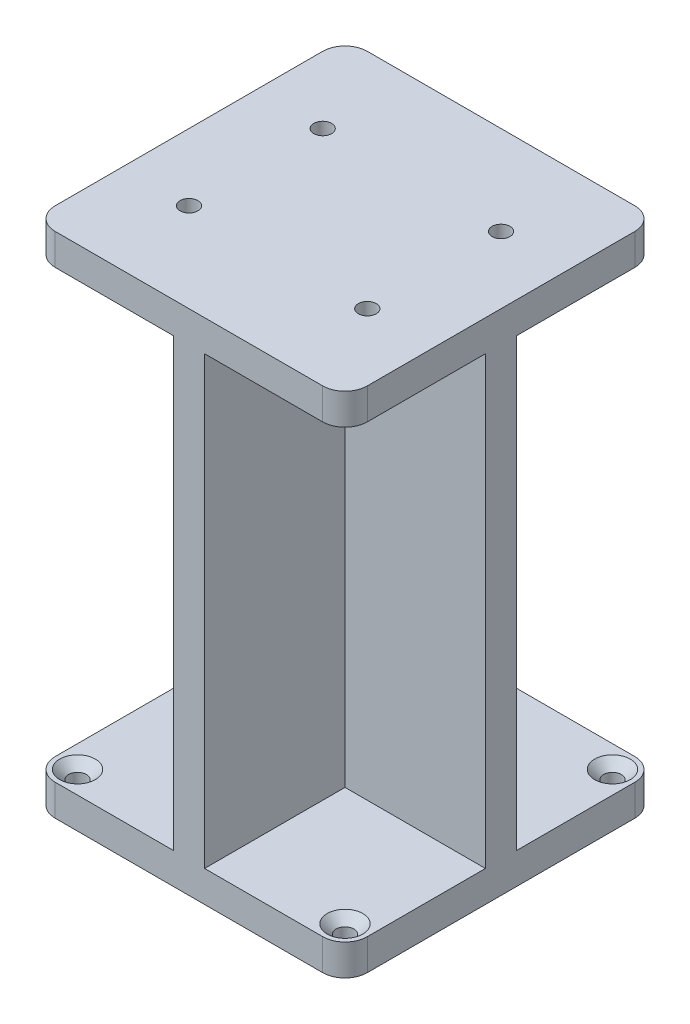
from build123d import *

# Parameters (mm, degrees)
SKETCH1_R           = 2
BOSS_EXTRUDE1_DEPTH = 3.5
BOSS_EXTRUDE2_DEPTH = 100
BOSS_EXTRUDE3_START = 7
SKETCH3_R           = 2
BOSS_EXTRUDE3_DEPTH = 7
CHAMFER1_SIZE       = 2


with BuildPart() as part:
    # Sketch1 → Boss-Extrude1 (new, symmetric)
    with BuildSketch(Plane(origin=(0, 0, 0), x_dir=(1, 0, 0), z_dir=(0, 1, 0))):
        with BuildLine():
            Line((-30, 35), (30, 35))
            ThreePointArc((30, 35), (33.535533906, 33.535533906), (35, 30))
            Line((35, 30), (35, -30))
            ThreePointArc((35, -30), (33.535533906, -33.535533906), (30, -35))
            Line((30, -35), (-30, -35))
            ThreePointArc((-30, -35), (-33.535533906, -33.535533906), (-35, -30))
            Line((-35, -30), (-35, 30))
            ThreePointArc((-35, 30), (-33.535533906, 33.535533906), (-30, 35))
        make_face()
        with Locations(Location((30, 30, 0), (0, 0, 270))):
            Circle(SKETCH1_R, mode=Mode.SUBTRACT)
        with Locations(Location((-30, 30, 0), (0, 0, 90))):
            Circle(SKETCH1_R, mode=Mode.SUBTRACT)
        with Locations(Location((30, -30, 0), (0, 0, 90))):
            Circle(SKETCH1_R, mode=Mode.SUBTRACT)
        with Locations(Location((-30, -30, 0), (0, 0, 270))):
            Circle(SKETCH1_R, mode=Mode.SUBTRACT)
    extrude(amount=BOSS_EXTRUDE1_DEPTH, both=True)

    # Sketch2 → Boss-Extrude2 (add)
    with BuildSketch(Plane(origin=(0, 3.5, 0), x_dir=(1, 0, 0), z_dir=(0, 1, 0))):
        Polygon((-3.5, 35), (3.5, 35), (3.5, 3.5), (35, 3.5), (35, -3.5), (3.5, -3.5), (3.5, -35), (-3.5, -35), (-3.5, -3.5), (-35, -3.5), (-35, 3.5), (-3.5, 3.5), align=None)
    extrude(amount=BOSS_EXTRUDE2_DEPTH)

    # Sketch3 → Boss-Extrude3 (add)
    with BuildSketch(Plane(origin=(0, 103.5, 0), x_dir=(1, 0, 0), z_dir=(0, 1, 0)).offset(BOSS_EXTRUDE3_START)):
        with BuildLine():
            Line((30, -35), (-30, -35))
            ThreePointArc((-30, -35), (-33.535533906, -33.535533906), (-35, -30))
            Line((-35, -30), (-35, 30))
            ThreePointArc((-35, 30), (-33.535533906, 33.535533906), (-30, 35))
            Line((-30, 35), (30, 35))
            ThreePointArc((30, 35), (33.535533906, 33.535533906), (35, 30))
            Line((35, 30), (35, -30))
            ThreePointArc((35, -30), (33.535533906, -33.535533906), (30, -35))
        make_face()
        with Locations(Location((20, -15, 0), (0, 0, 270))):
            Circle(SKETCH3_R, mode=Mode.SUBTRACT)
        with Locations(Location((20, 15, 0), (0, 0, 270))):
            Circle(SKETCH3_R, mode=Mode.SUBTRACT)
        with Locations(Location((-20, 15, 0), (0, 0, 90))):
            Circle(SKETCH3_R, mode=Mode.SUBTRACT)
        with Locations(Location((-20, -15, 0), (0, 0, 90))):
            Circle(SKETCH3_R, mode=Mode.SUBTRACT)
    extrude(amount=-BOSS_EXTRUDE3_DEPTH)

    # Chamfer1
    chamfer1_edges = [part.edges().sort_by_distance(p)[0] for p in [
        (30, 3.5, -32),
        (-30, 3.5, -28),
        (30, 3.5, 32),
        (-30, 3.5, 28),
    ]]
    chamfer(chamfer1_edges, length=CHAMFER1_SIZE)


solid = part.part
